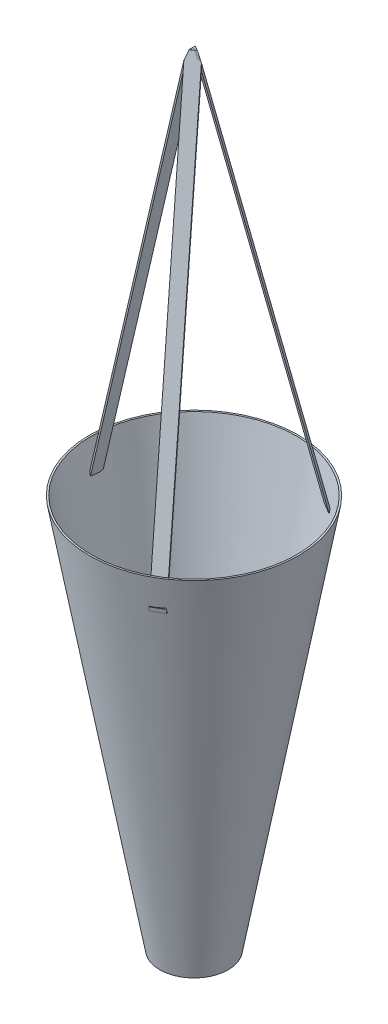
from build123d import *

# Parameters (mm, degrees)
BOSS_EXTRUDE1_DEPTH      = 9.525
BOSS_EXTRUDE1_DEPTH_BACK = 9.525
CIRPATTERN2_COUNT        = 3
CUT_EXTRUDE2_DEPTH       = 9.525
CUT_EXTRUDE3_DEPTH       = 9.525
SKETCH5_W                = 19.16873437
SKETCH5_H                = 21.353350775
CUT_EXTRUDE4_DEPTH       = 9.525


with BuildPart() as part:
    # Sketch1 → Revolve1 (revolve)
    with BuildSketch(Plane.XY):
        Polygon((-152.4, 0), (-154.94, 0), (-50.8, -584.2), (-48.26, -584.2), align=None)
    revolve(axis=Axis((0, 0, 0), (0, -1, 0)))


with BuildPart() as body_2:
    # Sketch2 → Boss-Extrude1 (new, two sides: drawn at the far end of the back side and taken through both)
    with BuildSketch(Plane.XY.offset(-BOSS_EXTRUDE1_DEPTH_BACK)):
        Polygon((-147.016304348, -44.45), (-2.54, 573.895855878), (0, 573.895855878), (-145.917078747, -50.616387514), align=None)
    extrude(amount=BOSS_EXTRUDE1_DEPTH + BOSS_EXTRUDE1_DEPTH_BACK)


with BuildPart() as cirpattern2_1:
    # CirPattern2: pattern copy
    add(body_2.part.rotate(Axis((0, 0, 0), (0, 1, 0)), 1 * 360 / CIRPATTERN2_COUNT))


with BuildPart() as cirpattern2_2:
    # CirPattern2: pattern copy
    add(body_2.part.rotate(Axis((0, 0, 0), (0, 1, 0)), 2 * 360 / CIRPATTERN2_COUNT))


with BuildPart() as cut_extrude2_tool:
    # Sketch3 → Cut-Extrude2 (new body)
    with BuildSketch(Plane(origin=(64.778869389, 30.271122739, -112.200293038), x_dir=(-0.8734652456991303, 0.1268250384797258, -0.4700785829735003), z_dir=(0.4868865006916478, 0.22752173913043477, -0.8433121567173715))):
        Polygon((63.265227426, 554.751830163), (60.577854189, 534.293710414), (79.454635817, 531.814061338), (82.142009054, 552.272181087), align=None)
    extrude(amount=CUT_EXTRUDE2_DEPTH)


with BuildPart() as body_2_1:
    add(body_2.part)

    # Cut-Extrude2: cut by cut_extrude2_tool
    add(cut_extrude2_tool.part, mode=Mode.SUBTRACT)


with BuildPart() as cirpattern2_1_1:
    add(cirpattern2_1.part)

    # Cut-Extrude2: cut by cut_extrude2_tool
    add(cut_extrude2_tool.part, mode=Mode.SUBTRACT)


with BuildPart() as cut_extrude3_tool:
    # Sketch4 → Cut-Extrude3 (new body)
    with BuildSketch(Plane(origin=(64.778869389, 30.271122739, 112.200293038), x_dir=(0.8734652456991238, -0.12682503847972984, -0.4700785829735115), z_dir=(0.4868865006916596, 0.22752173913043477, 0.8433121567173646))):
        Polygon((-82.152966833, 552.270741676), (-79.695461902, 533.5625364), (-60.708482562, 536.056661019), (-63.165987493, 554.764866294), align=None)
    extrude(amount=CUT_EXTRUDE3_DEPTH)


with BuildPart() as body_2_2:
    add(body_2_1.part)

    # Cut-Extrude3: cut by cut_extrude3_tool
    add(cut_extrude3_tool.part, mode=Mode.SUBTRACT)


with BuildPart() as cirpattern2_2_1:
    add(cirpattern2_2.part)

    # Cut-Extrude3: cut by cut_extrude3_tool
    add(cut_extrude3_tool.part, mode=Mode.SUBTRACT)


with BuildPart() as cut_extrude4_tool:
    # Sketch5 → Cut-Extrude4 (new body)
    with BuildSketch(Plane(origin=(-129.557738777, 30.271122739, 0), x_dir=(0, 0, 1), z_dir=(-0.9737730013833114, 0.2275217391304348, 0))):
        with Locations((0.059367185, 549.115957065)):
            Rectangle(SKETCH5_W, SKETCH5_H)
    extrude(amount=CUT_EXTRUDE4_DEPTH)


with BuildPart() as cirpattern2_1_2:
    add(cirpattern2_1_1.part)

    # Cut-Extrude4: cut by cut_extrude4_tool
    add(cut_extrude4_tool.part, mode=Mode.SUBTRACT)


with BuildPart() as cirpattern2_2_2:
    add(cirpattern2_2_1.part)

    # Cut-Extrude4: cut by cut_extrude4_tool
    add(cut_extrude4_tool.part, mode=Mode.SUBTRACT)


solid = Compound([part.part, body_2_2.part, cirpattern2_1_2.part, cirpattern2_2_2.part])
